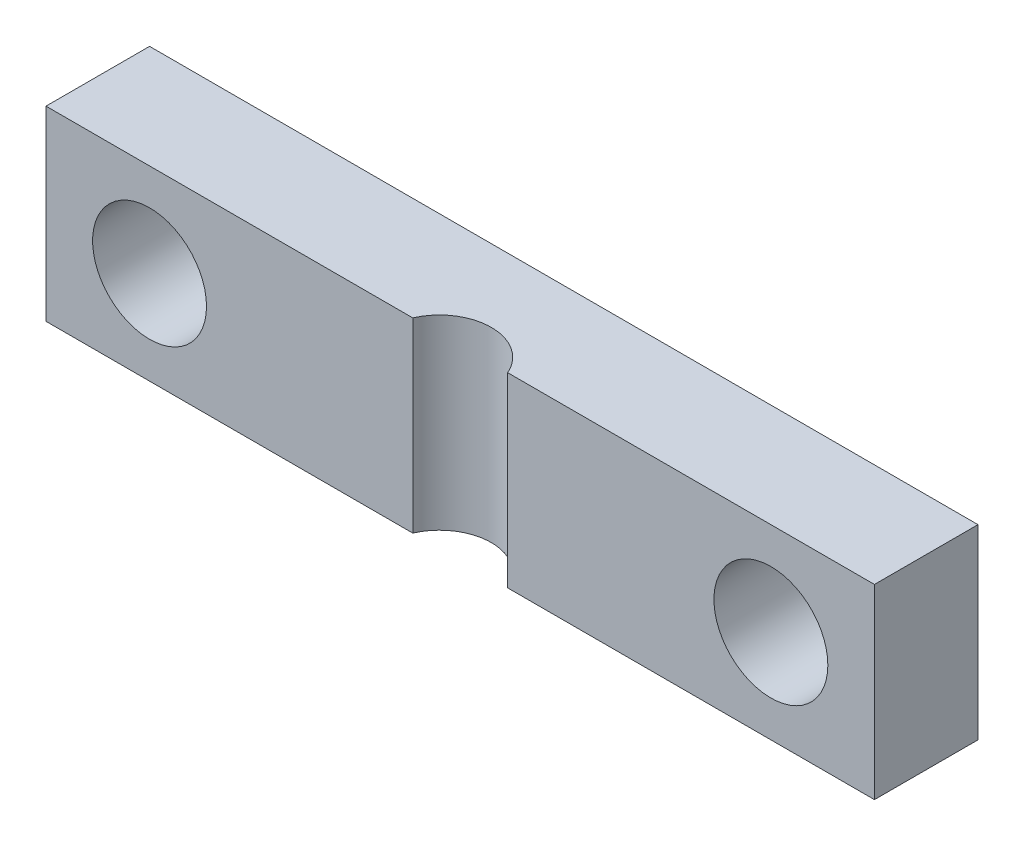
from build123d import *

# Parameters (mm, degrees)
SKETCH_1_W          = 40
SKETCH_1_H          = 9
EXTRUDE_1_DEPTH     = 5
SKETCH_2_R          = 2.75
CUT_EXTRUDE_1_DEPTH = 10
SKETCH_3_R          = 2.5
CUT_EXTRUDE_2_DEPTH = 10


with BuildPart() as part:
    # 草图1 → 凸台-拉伸1 (new body)
    with BuildSketch(Plane.XY):
        with Locations((0, 4.5)):
            Rectangle(SKETCH_1_W, SKETCH_1_H)
    extrude(amount=EXTRUDE_1_DEPTH)

    # 草图2 → 切除-拉伸1 (cut)
    with BuildSketch(Plane.XY.offset(5)):
        with Locations((15, 4.5)):
            Circle(SKETCH_2_R)
        with Locations((-15, 4.5)):
            Circle(SKETCH_2_R)
    extrude(amount=-CUT_EXTRUDE_1_DEPTH, mode=Mode.SUBTRACT)

    # 草图3 → 切除-拉伸2 (cut)
    with BuildSketch(Plane(origin=(0, 9, 0), x_dir=(1, 0, 0), z_dir=(0, 1, 0))):
        with Locations((0, -6)):
            Circle(SKETCH_3_R)
    extrude(amount=-CUT_EXTRUDE_2_DEPTH, mode=Mode.SUBTRACT)


solid = part.part
